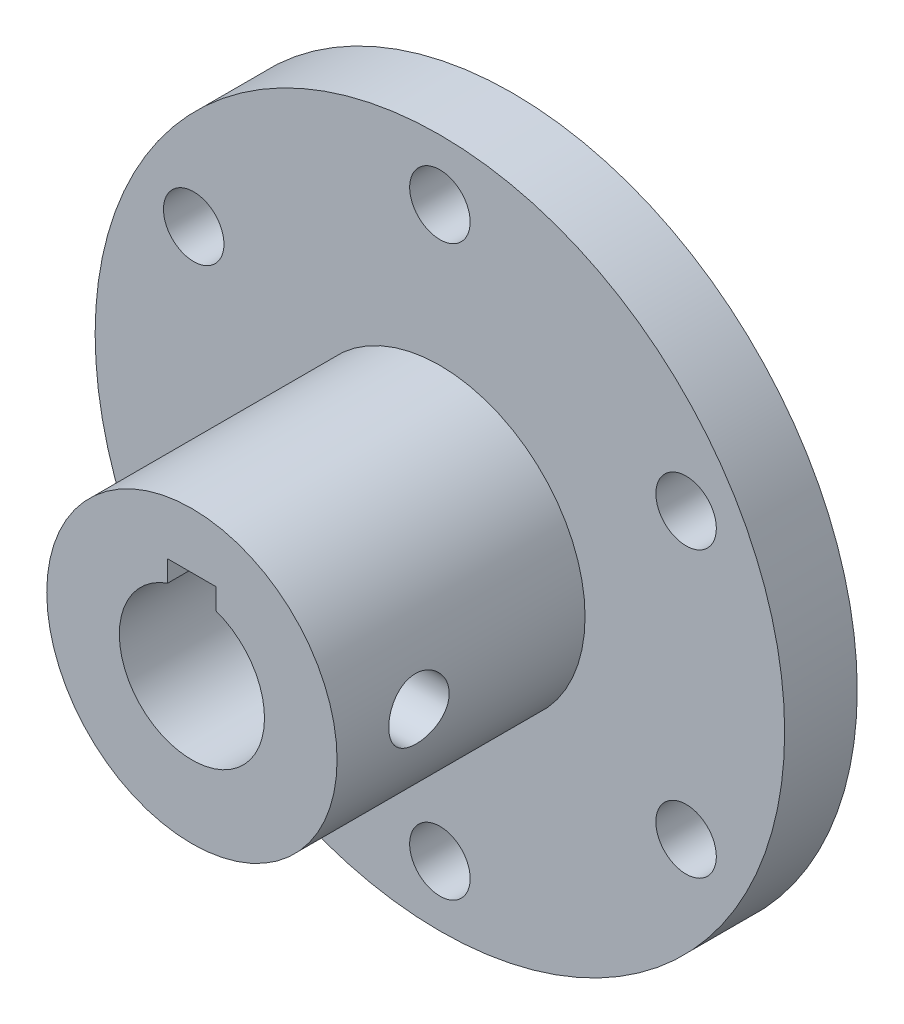
from build123d import *

# Parameters (mm, degrees)
SKETCH_1_R              = 28.5
SKETCH_1_R_2            = 6
EXTRUDE_1_DEPTH         = 6
SKETCH_2_R              = 12
SKETCH_2_R_2            = 6
EXTRUDE_2_DEPTH         = 20.5
HOLE_WIZARD_1_4_1_D     = 4.999999906
HOLE_WIZARD_1_4_1_DEPTH = 10
SKETCH_5_R              = 2.5
CUT_EXTRUDE_1_DEPTH     = 30
CUT_EXTRUDE_START       = -100
CUT_EXTRUDE_2_DEPTH     = 100


with BuildPart() as part:
    # ｽｹｯﾁ1 → ﾎﾞｽ - 押し出し1 (new body)
    with BuildSketch(Plane.XY):
        Circle(SKETCH_1_R)
        Circle(SKETCH_1_R_2, mode=Mode.SUBTRACT)
    extrude(amount=EXTRUDE_1_DEPTH)

    # ｽｹｯﾁ2 → ﾎﾞｽ - 押し出し2 (add)
    with BuildSketch(Plane.XY.offset(6)):
        Circle(SKETCH_2_R)
        Circle(SKETCH_2_R_2, mode=Mode.SUBTRACT)
    extrude(amount=EXTRUDE_2_DEPTH)

    # 1/4 すきま穴1
    with Locations(Plane(origin=(11.999037225, 0.152005526, 19.728327371), x_dir=(-0.012667127201, 0.999919768726, 0), z_dir=(0.999919768726, 0.012667127201, 0))):
        with Locations((0, 0)):
            Hole(HOLE_WIZARD_1_4_1_D / 2, depth=HOLE_WIZARD_1_4_1_DEPTH)

    # ｽｹｯﾁ5 → ｶｯﾄ - 押し出し1 (cut)
    with BuildSketch(Plane.XY.offset(6)):
        with BuildLine():
            ThreePointArc((-17.851596989, 11.75), (-17.936782423, 12.397047613), (-18.186533479, 13))
            Line((-18.186533479, 13), (-20.351596989, 11.75))
            Line((-20.351596989, 11.75), (-20.351596989, 9.25))
            ThreePointArc((-20.351596989, 9.25), (-18.583830036, 9.982233047), (-17.851596989, 11.75))
        make_face()
        with BuildLine():
            Line((-20.351596989, 11.75), (-18.186533479, 13))
            ThreePointArc((-18.186533479, 13), (-22.516660498, 13), (-20.351596989, 9.25))
            Line((-20.351596989, 9.25), (-20.351596989, 11.75))
        make_face()
        with BuildLine():
            ThreePointArc((22.851596989, 11.75), (20.998644602, 14.164814566), (18.186533479, 13))
            Line((18.186533479, 13), (20.351596989, 11.75))
            Line((20.351596989, 11.75), (20.351596989, 9.25))
            ThreePointArc((20.351596989, 9.25), (22.119363942, 9.982233047), (22.851596989, 11.75))
        make_face()
        with BuildLine():
            Line((20.351596989, 11.75), (18.186533479, 13))
            ThreePointArc((18.186533479, 13), (18.186533479, 10.5), (20.351596989, 9.25))
            Line((20.351596989, 9.25), (20.351596989, 11.75))
        make_face()
        with Locations((0, 23.5)):
            Circle(SKETCH_5_R)
        with Locations((-20.351596989, -11.75)):
            Circle(SKETCH_5_R)
        with Locations((0, -23.5)):
            Circle(SKETCH_5_R)
        with Locations((20.351596989, -11.75)):
            Circle(SKETCH_5_R)
    extrude(amount=-CUT_EXTRUDE_1_DEPTH, mode=Mode.SUBTRACT)

    # ｽｹｯﾁ6 → ｶｯﾄ - 押し出し2 (cut)
    with BuildSketch(Plane.XY.offset(26.5).offset(CUT_EXTRUDE_START)):
        with BuildLine():
            Line((-2, 7.4), (-2, 5.656854249))
            ThreePointArc((-2, 5.656854249), (0, 6), (2, 5.656854249))
            Line((2, 5.656854249), (2, 7.4))
            Line((2, 7.4), (-2, 7.4))
        make_face()
    extrude(amount=CUT_EXTRUDE_2_DEPTH, mode=Mode.SUBTRACT)


solid = part.part
